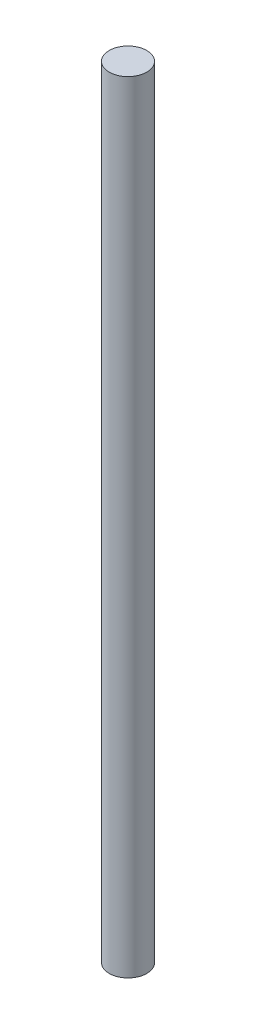
from build123d import *

# Parameters (mm, degrees)
SZKIC1_R                    = 2.5
DODANIE_WYCI_GNI_CIE1_DEPTH = 104


with BuildPart() as part:
    # Szkic1 → Dodanie-wyciągnięcie1 (new body)
    with BuildSketch(Plane(origin=(0, 0, 0), x_dir=(1, 0, 0), z_dir=(0, 1, 0))):
        with Locations(Location((0, 0, 0), (0, 0, 90))):
            Circle(SZKIC1_R)
    extrude(amount=DODANIE_WYCI_GNI_CIE1_DEPTH)


solid = part.part
